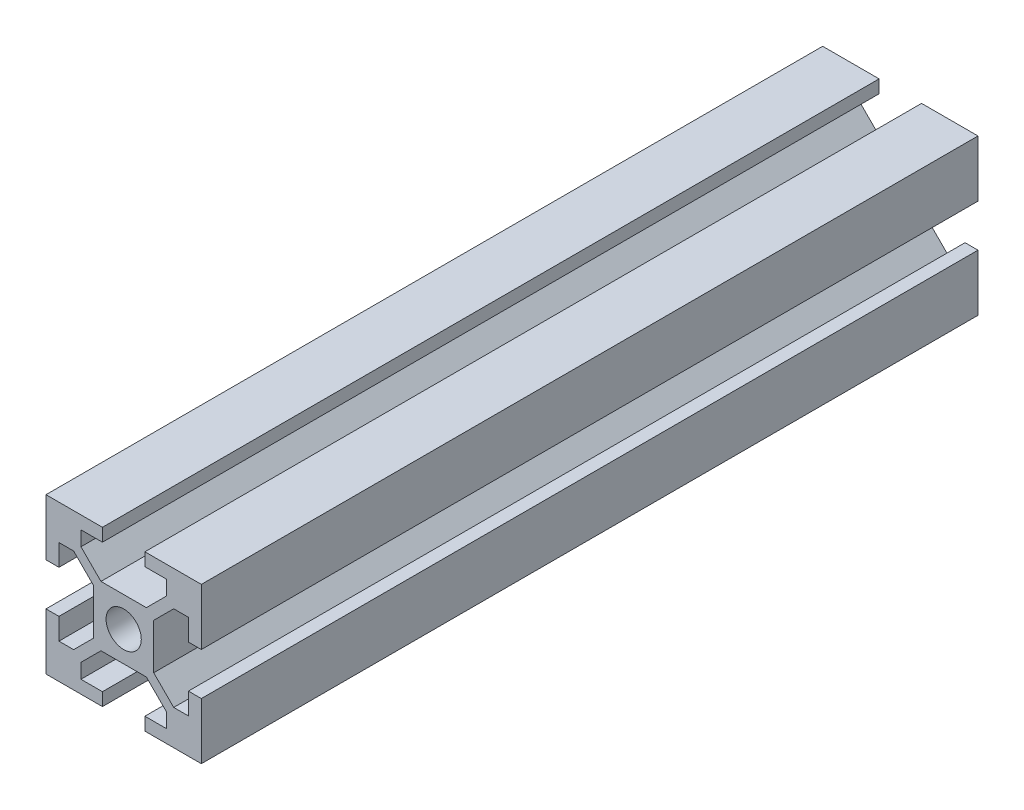
from build123d import *

# Parameters (mm, degrees)
SKETCH_1_R      = 3.4
EXTRUDE_1_DEPTH = 150


with BuildPart() as part:
    # 草图1 → 凸台-拉伸1 (new body)
    with BuildSketch(Plane.XY):
        Polygon((-4.1, 12.5), (-4.1, 15), (-8.25, 15), (-15, 15), (-15, 8.25), (-15, 4.1), (-12.5, 4.1), (-12.5, 8.25), (-9.664213562, 8.25), (-5.8, 4.385786438), (-5.8, -4.385786438), (-9.664213562, -8.25), (-12.5, -8.25), (-12.5, -4.1), (-15, -4.1), (-15, -8.25), (-15, -15), (-8.25, -15), (-4.1, -15), (-4.1, -12.5), (-8.25, -12.5), (-8.25, -9.664213562), (-4.385786438, -5.8), (4.385786438, -5.8), (8.25, -9.664213562), (8.25, -12.5), (4.1, -12.5), (4.1, -15), (8.25, -15), (15, -15), (15, -8.25), (15, -4.1), (12.5, -4.1), (12.5, -8.25), (9.664213562, -8.25), (5.8, -4.385786438), (5.8, 4.385786438), (9.664213562, 8.25), (12.5, 8.25), (12.5, 4.1), (15, 4.1), (15, 8.25), (15, 15), (8.25, 15), (4.1, 15), (4.1, 12.5), (8.25, 12.5), (8.25, 9.664213562), (4.385786438, 5.8), (-4.385786438, 5.8), (-8.25, 9.664213562), (-8.25, 12.5), align=None)
        Circle(SKETCH_1_R, mode=Mode.SUBTRACT)
    extrude(amount=EXTRUDE_1_DEPTH)


solid = part.part
